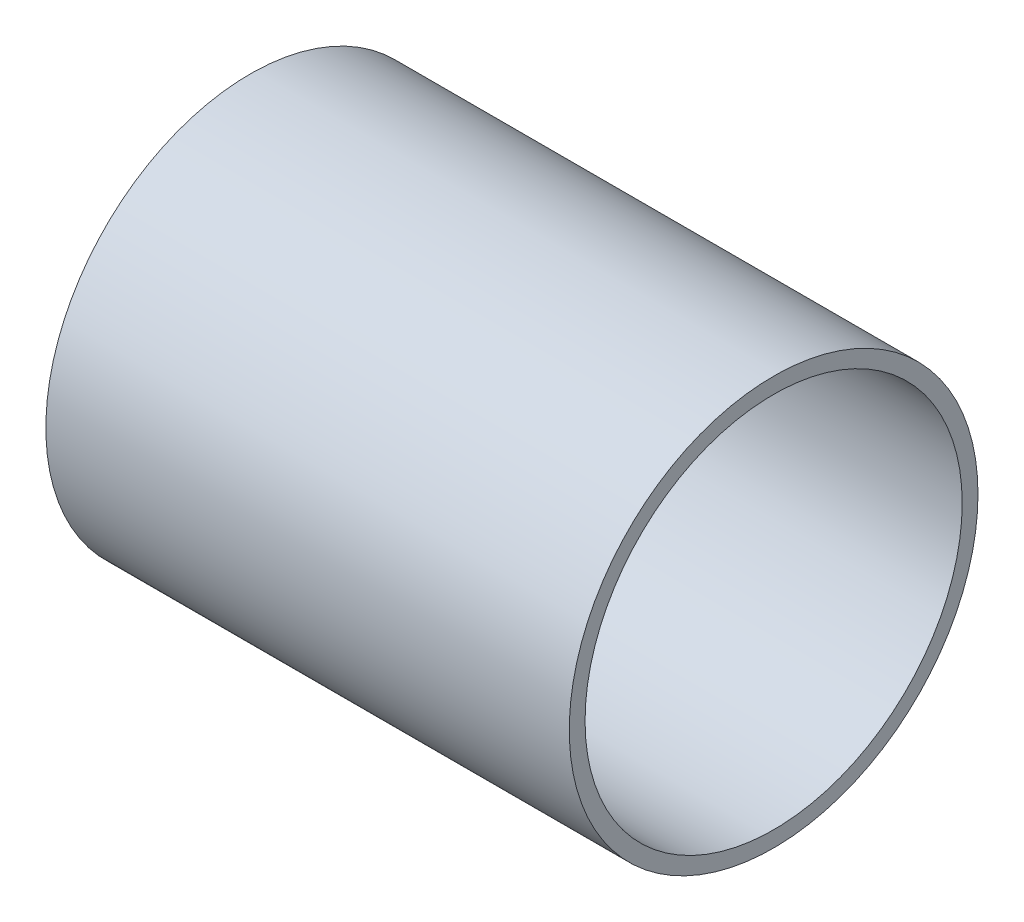
from build123d import *

# Parameters (mm, degrees)
SKETCH3_R           = 43.24059598
BOSS_EXTRUDE2_DEPTH = 110.744
SKETCH4_R           = 39.897780391
CUT_EXTRUDE1_DEPTH  = 110.744


with BuildPart() as part:
    # Sketch3 → Boss-Extrude2 (new body)
    with BuildSketch(Plane(origin=(0, 0, 0), x_dir=(0, 0, -1), z_dir=(1, 0, 0))):
        Circle(SKETCH3_R)
    extrude(amount=BOSS_EXTRUDE2_DEPTH)

    # Sketch4 → Cut-Extrude1 (cut)
    with BuildSketch(Plane(origin=(110.744, 0, 0), x_dir=(0, 0, -1), z_dir=(1, 0, 0))):
        Circle(SKETCH4_R)
    extrude(amount=-CUT_EXTRUDE1_DEPTH, mode=Mode.SUBTRACT)


solid = part.part
